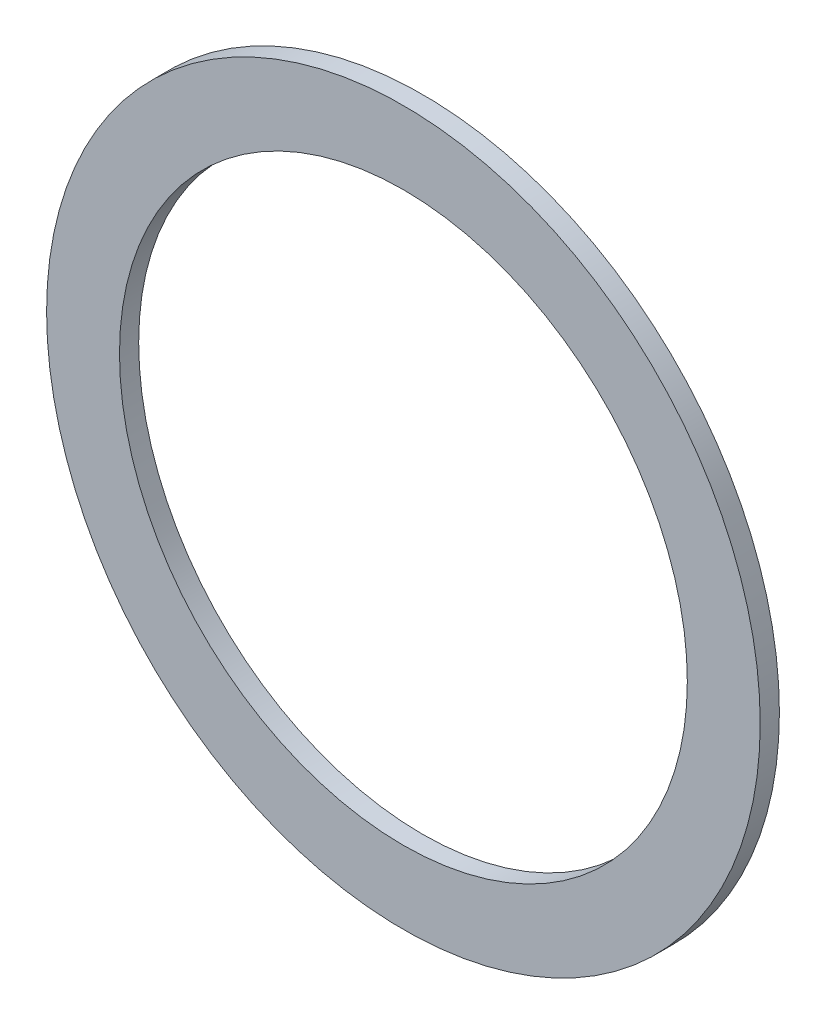
from build123d import *

# Parameters (mm, degrees)
IZIM1_R                     = 9.3
IZIM1_R_2                   = 7.4
Y_KSEKLIK_EKSTR_ZYON1_DEPTH = 0.5


with BuildPart() as part:
    # Çizim1 → Yükseklik-Ekstrüzyon1 (new body)
    with BuildSketch(Plane.XY):
        Circle(IZIM1_R)
        Circle(IZIM1_R_2, mode=Mode.SUBTRACT)
    extrude(amount=Y_KSEKLIK_EKSTR_ZYON1_DEPTH)


solid = part.part
